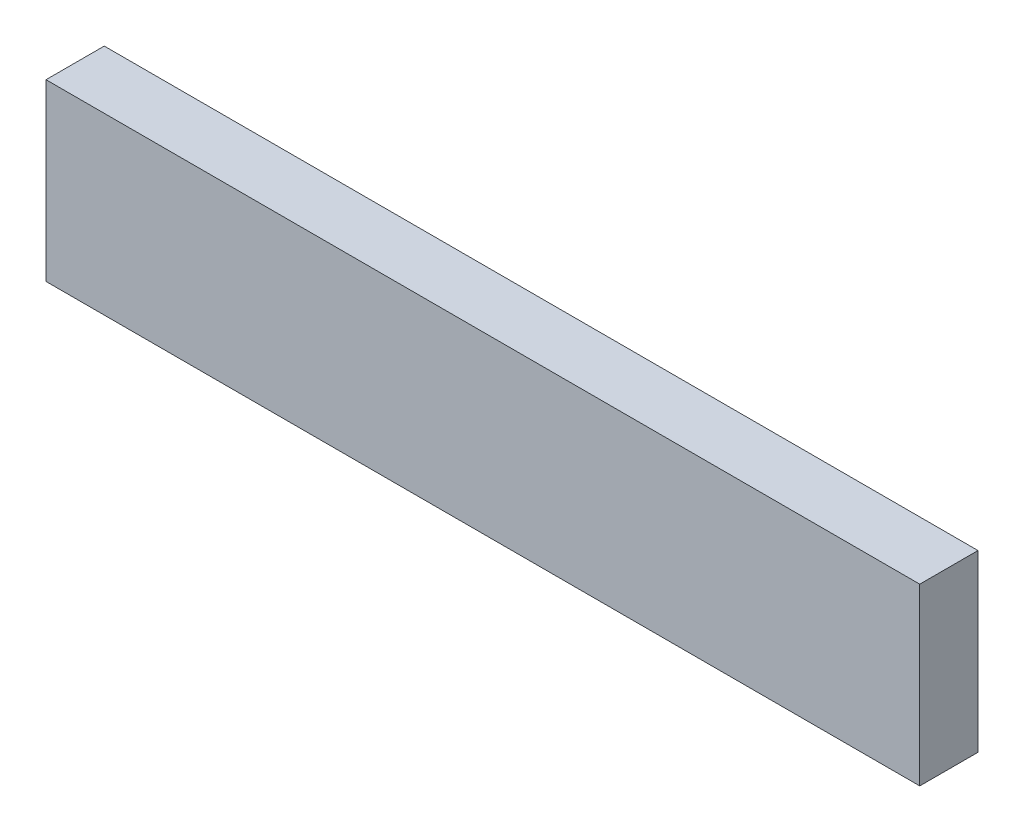
from build123d import *

# Parameters (mm, degrees)
SKETCH_1_W      = 300
SKETCH_1_H      = 60
EXTRUDE_1_DEPTH = 20


with BuildPart() as part:
    # 草图1 → 凸台-拉伸1 (new body)
    with BuildSketch(Plane.XY):
        Rectangle(SKETCH_1_W, SKETCH_1_H)
    extrude(amount=EXTRUDE_1_DEPTH)


solid = part.part
